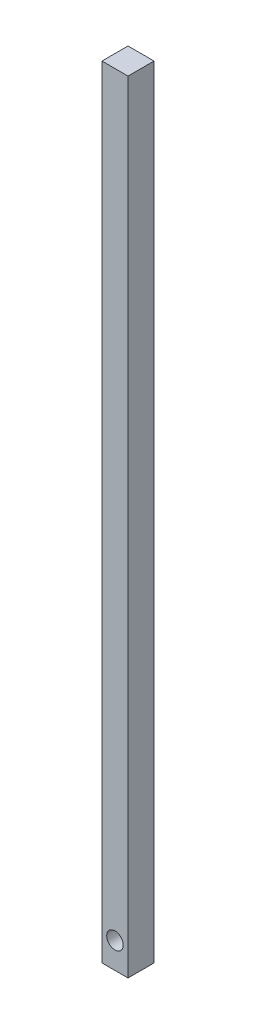
from build123d import *

# Parameters (mm, degrees)
SKETCH1_W           = 10
SKETCH1_H           = 10
BOSS_EXTRUDE1_DEPTH = 300
SKETCH2_R           = 3.175
CUT_EXTRUDE1_DEPTH  = 301.333148354


with BuildPart() as part:
    # Sketch1 → Boss-Extrude1 (new body)
    with BuildSketch(Plane(origin=(0, 0, 0), x_dir=(1, 0, 0), z_dir=(0, 1, 0))):
        with Locations((5, 5)):
            Rectangle(SKETCH1_W, SKETCH1_H)
    extrude(amount=BOSS_EXTRUDE1_DEPTH)

    # Sketch2 → Cut-Extrude1 (cut, through all)
    with BuildSketch(Plane.XY):
        with Locations((5, 10)):
            Circle(SKETCH2_R)
    extrude(amount=-CUT_EXTRUDE1_DEPTH, mode=Mode.SUBTRACT)


solid = part.part
